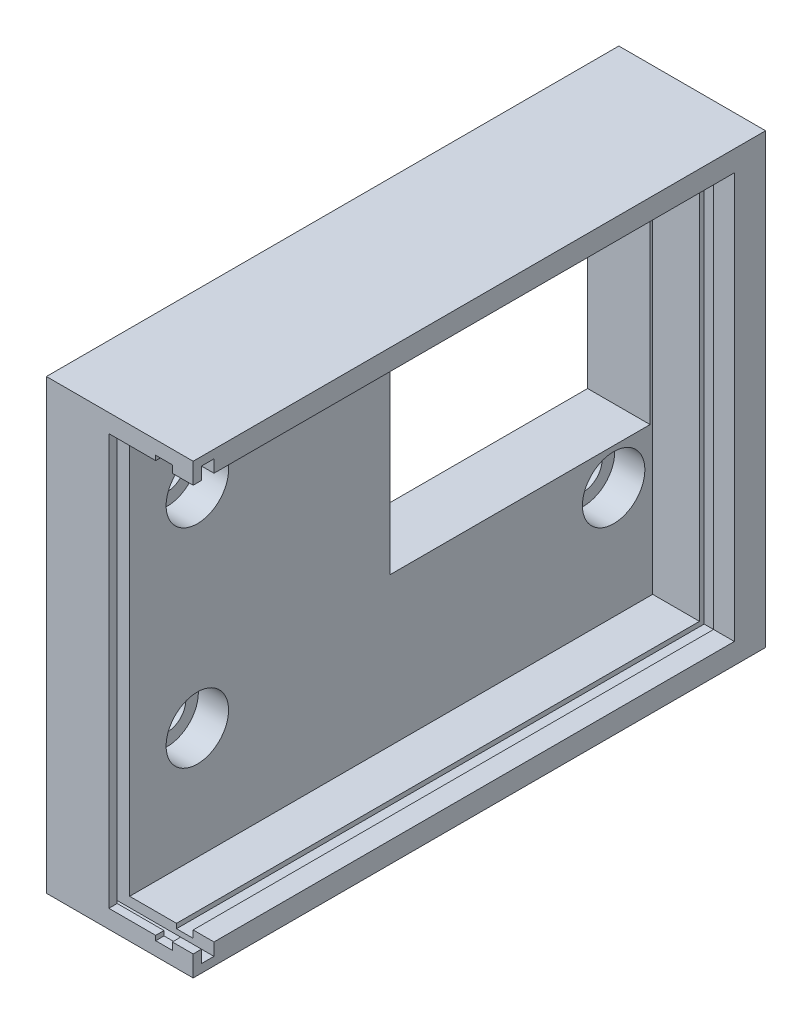
from build123d import *

# Parameters (mm, degrees)
SKETCH1_W           = 43
SKETCH1_H           = 55
SKETCH1_R           = 1.8
BOSS_EXTRUDE1_DEPTH = 6
BOSS_EXTRUDE2_DEPTH = 4.5
BOSS_EXTRUDE3_DEPTH = 1.6
BOSS_EXTRUDE4_DEPTH = 2
SKETCH7_R           = 3
CUT_EXTRUDE2_DEPTH  = 11
SKETCH11_W          = 25
SKETCH11_H          = 25
CUT_EXTRUDE5_DEPTH  = 11.5
SKETCH17_W          = 41.4
SKETCH17_H          = 1.2
CUT_EXTRUDE7_DEPTH  = 11


with BuildPart() as part:
    # Sketch1 → Boss-Extrude1 (new body)
    with BuildSketch(Plane.YZ):
        with Locations((-2.736471392, 0.837454611)):
            Rectangle(SKETCH1_W, SKETCH1_H)
        with Locations(Location((-11.736471392, -20.162545389, 0), (0, 0, 270))):
            Circle(SKETCH1_R, mode=Mode.SUBTRACT)
        with Locations(Location((-11.736471392, 19.837454611, 0), (0, 0, 270))):
            Circle(SKETCH1_R, mode=Mode.SUBTRACT)
        with Locations(Location((8.263528608, 19.837454611, 0), (0, 0, 270))):
            Circle(SKETCH1_R, mode=Mode.SUBTRACT)
    extrude(amount=BOSS_EXTRUDE1_DEPTH)

    # Sketch3 → Boss-Extrude2 (add)
    with BuildSketch(Plane.YZ.offset(6)):
        Polygon((-22.486471392, 25.587454611), (-22.486471392, 28.337454611), (-24.236471392, 28.337454611), (-24.236471392, -26.662545389), (18.763528608, -26.662545389), (18.763528608, 28.337454611), (17.013528608, 28.337454611), (17.013528608, 25.587454611), (17.013528608, -23.912545389), (-22.486471392, -23.912545389), align=None)
    extrude(amount=BOSS_EXTRUDE2_DEPTH)

    # Sketch5 → Boss-Extrude3 (add)
    with BuildSketch(Plane.YZ.offset(10.5)):
        Polygon((-22.936471392, 26.037454611), (-22.936471392, 28.337454611), (-24.236471392, 28.337454611), (-24.236471392, -26.662545389), (18.763528608, -26.662545389), (18.763528608, 28.337454611), (17.463528608, 28.337454611), (17.463528608, 26.037454611), (17.463528608, -24.362545389), (-22.936471392, -24.362545389), align=None)
    extrude(amount=BOSS_EXTRUDE3_DEPTH)

    # Sketch6 → Boss-Extrude4 (add)
    with BuildSketch(Plane.YZ.offset(12.1)):
        Polygon((-22.236471392, 25.337454611), (-22.236471392, 28.337454611), (-24.236471392, 28.337454611), (-24.236471392, -26.662545389), (18.763528608, -26.662545389), (18.763528608, 28.337454611), (16.763528608, 28.337454611), (16.763528608, 25.337454611), (16.763528608, -23.662545389), (-22.236471392, -23.662545389), align=None)
    extrude(amount=BOSS_EXTRUDE4_DEPTH)

    # Sketch7 → Cut-Extrude2 (cut)
    with BuildSketch(Plane.YZ.offset(14.1)):
        with Locations(Location((-11.736471392, -20.162545389, 0), (0, 0, 270))):
            Circle(SKETCH7_R)
        with Locations(Location((-11.736471392, 19.837454611, 0), (0, 0, 270))):
            Circle(SKETCH7_R)
        with Locations(Location((8.263528608, 19.837454611, 0), (0, 0, 270))):
            Circle(SKETCH7_R)
    extrude(amount=-CUT_EXTRUDE2_DEPTH, mode=Mode.SUBTRACT)

    # Sketch11 → Cut-Extrude5 (cut)
    with BuildSketch(Plane.YZ.offset(6)):
        with Locations((4.263528608, -11.162545389)):
            Rectangle(SKETCH11_W, SKETCH11_H)
    extrude(amount=-CUT_EXTRUDE5_DEPTH, mode=Mode.SUBTRACT)

    # Sketch17 → Cut-Extrude7 (cut)
    with BuildSketch(Plane.YZ.offset(14.1)):
        with Locations((-2.736471392, 26.937454611)):
            Rectangle(SKETCH17_W, SKETCH17_H)
    extrude(amount=-CUT_EXTRUDE7_DEPTH, mode=Mode.SUBTRACT)


solid = part.part
